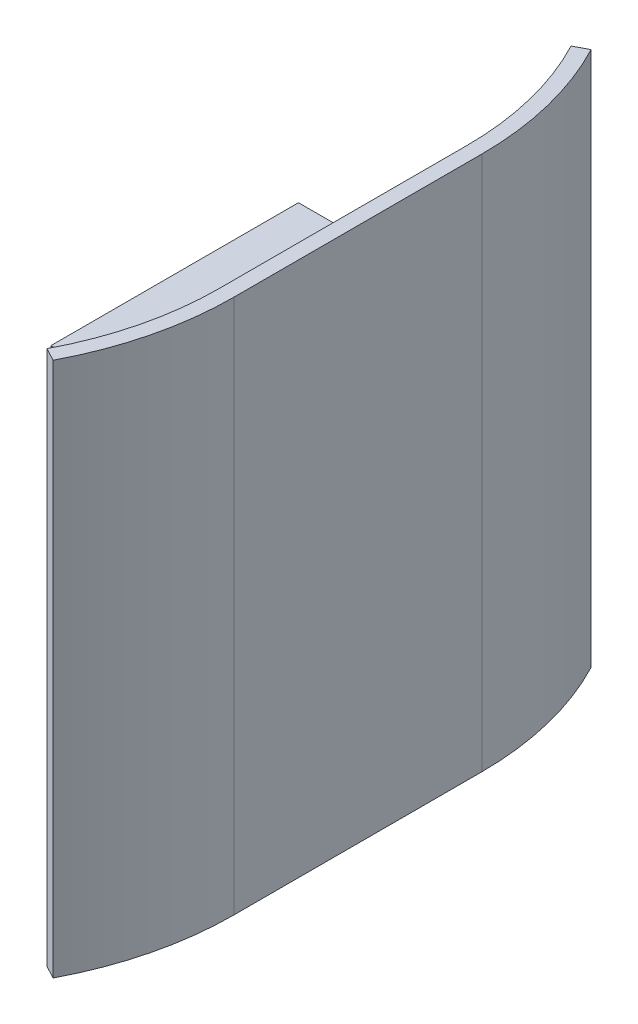
from build123d import *

# Parameters (mm, degrees)
IZIM1_W               = 34
IZIM1_H               = 54
IZIM1_W_2             = 30
IZIM1_H_2             = 50
EKSTR_ZYON_NCE1_DEPTH = 50
KES_EKSTR_ZYON1_REACH = 81.75
IZIM2_R               = 4
IZIM2_R_2             = 2
EKSTR_ZYON_NCE2_DEPTH = 27


with BuildPart() as part:
    # Çizim1 → Ekstrüzyon-İnce1 (new body)
    with BuildSketch(Plane.XY):
        with Locations((15, 25)):
            Rectangle(IZIM1_W, IZIM1_H)
        with Locations((15, 25)):
            Rectangle(IZIM1_W_2, IZIM1_H_2, mode=Mode.SUBTRACT)
    extrude(amount=EKSTR_ZYON_NCE1_DEPTH)

    # Çizim2 → Kes-Ekstrüzyon1 (cut, up to next)
    with BuildSketch(Plane.ZY.offset(2), mode=Mode.PRIVATE) as kes_ekstr_zyon1_sk1:
        with Locations((25, 25)):
            Circle(IZIM2_R)
    kes_ekstr_zyon1_tool1 = extrude(kes_ekstr_zyon1_sk1.sketch, amount=-KES_EKSTR_ZYON1_REACH, mode=Mode.PRIVATE) & part.part
    # Çizim2 → Kes-Ekstrüzyon1 (cut, up to next)
    with BuildSketch(Plane.ZY.offset(2), mode=Mode.PRIVATE) as kes_ekstr_zyon1_sk2:
        with Locations((33, 25)):
            Circle(IZIM2_R_2)
    kes_ekstr_zyon1_tool2 = extrude(kes_ekstr_zyon1_sk2.sketch, amount=-KES_EKSTR_ZYON1_REACH, mode=Mode.PRIVATE) & part.part
    # Çizim2 → Kes-Ekstrüzyon1 (cut, up to next)
    with BuildSketch(Plane.ZY.offset(2), mode=Mode.PRIVATE) as kes_ekstr_zyon1_sk3:
        with Locations(Location((17, 25, 0), (0, 0, 180))):
            Circle(IZIM2_R_2)
    kes_ekstr_zyon1_tool3 = extrude(kes_ekstr_zyon1_sk3.sketch, amount=-KES_EKSTR_ZYON1_REACH, mode=Mode.PRIVATE) & part.part
    # Çizim2 → Kes-Ekstrüzyon1 (cut, up to next)
    with BuildSketch(Plane.ZY.offset(2), mode=Mode.PRIVATE) as kes_ekstr_zyon1_sk4:
        with Locations((25, 33)):
            Circle(IZIM2_R_2)
    kes_ekstr_zyon1_tool4 = extrude(kes_ekstr_zyon1_sk4.sketch, amount=-KES_EKSTR_ZYON1_REACH, mode=Mode.PRIVATE) & part.part
    # Çizim2 → Kes-Ekstrüzyon1 (cut, up to next)
    with BuildSketch(Plane.ZY.offset(2), mode=Mode.PRIVATE) as kes_ekstr_zyon1_sk5:
        with Locations(Location((25, 17, 0), (0, 0, 180))):
            Circle(IZIM2_R_2)
    kes_ekstr_zyon1_tool5 = extrude(kes_ekstr_zyon1_sk5.sketch, amount=-KES_EKSTR_ZYON1_REACH, mode=Mode.PRIVATE) & part.part
    add(kes_ekstr_zyon1_tool1.solids().sort_by_distance((-2, 25, 25))[0], mode=Mode.SUBTRACT)
    add(kes_ekstr_zyon1_tool2.solids().sort_by_distance((-2, 25, 33))[0], mode=Mode.SUBTRACT)
    add(kes_ekstr_zyon1_tool3.solids().sort_by_distance((-2, 25, 17))[0], mode=Mode.SUBTRACT)
    add(kes_ekstr_zyon1_tool4.solids().sort_by_distance((-2, 33, 25))[0], mode=Mode.SUBTRACT)
    add(kes_ekstr_zyon1_tool5.solids().sort_by_distance((-2, 17, 25))[0], mode=Mode.SUBTRACT)

    # Çizim3 → Ekstrüzyon-İnce2 (add, symmetric)
    with BuildSketch(Plane(origin=(0, 52, 0), x_dir=(1, 0, 0), z_dir=(0, 1, 0))):
        with BuildLine():
            ThreePointArc((25.118164338, -77.900907107), (30.254140884, -64.368544459), (32, -50))
            Line((32, -50), (32, 0))
            ThreePointArc((32, 0), (30.254140884, 14.368544459), (25.118164338, 27.900907107))
            Line((25.118164338, 27.900907107), (27.774072555, 29.295952462))
            ThreePointArc((27.774072555, 29.295952462), (33.166847928, 15.086971682), (35, 0))
            Line((35, 0), (35, -50))
            ThreePointArc((35, -50), (33.166847928, -65.086971682), (27.774072555, -79.295952462))
            Line((27.774072555, -79.295952462), (25.118164338, -77.900907107))
        make_face()
    ekstr_zyon_nce2 = extrude(amount=EKSTR_ZYON_NCE2_DEPTH, both=True)

    # Aynalama1: Ekstrüzyon-İnce2 across plane
    add(ekstr_zyon_nce2.mirror(Plane(origin=(-28, 25, 50), x_dir=(0, 0, 1), z_dir=(0, -1, 0))))


solid = part.part
